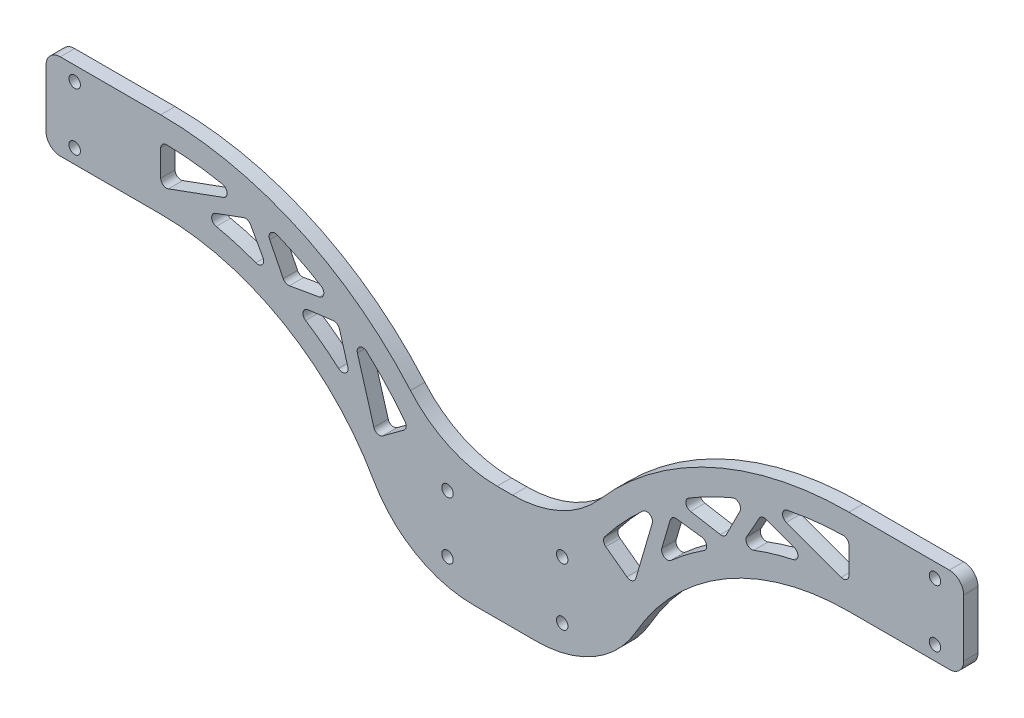
from build123d import *

# Parameters (mm, degrees)
ESQUISSE1_R        = 2
BOSS_EXTRU_1_DEPTH = 5
CONG_1_R           = 5
CONG_2_R           = 40
CONG_3_R           = 2


with BuildPart() as part:
    # Esquisse1 → Boss.-Extru.1 (new body)
    with BuildSketch(Plane.XY):
        with BuildLine():
            Line((-37.5, 0), (37.5, 0))
            ThreePointArc((37.5, 0), (67.945941561, 45.786768838), (120, 63.5))
            Line((120, 63.5), (160, 63.5))
            Line((160, 63.5), (160, 93.5))
            Line((160, 93.5), (120, 93.5))
            ThreePointArc((120, 93.5), (64.453511348, 79.243999919), (22.637791694, 40))
            Line((22.637791694, 40), (-22.637791694, 40))
            ThreePointArc((-22.637791694, 40), (-64.453511348, 79.243999919), (-120, 93.5))
            Line((-120, 93.5), (-160, 93.5))
            Line((-160, 93.5), (-160, 63.5))
            Line((-160, 63.5), (-120, 63.5))
            ThreePointArc((-120, 63.5), (-67.945941561, 45.786768838), (-37.5, 0))
        make_face()
        with Locations((20, 30)):
            Circle(ESQUISSE1_R, mode=Mode.SUBTRACT)
        with Locations((-20, 30)):
            Circle(ESQUISSE1_R, mode=Mode.SUBTRACT)
        with Locations((-20, 10)):
            Circle(ESQUISSE1_R, mode=Mode.SUBTRACT)
        with Locations((20, 10)):
            Circle(ESQUISSE1_R, mode=Mode.SUBTRACT)
        with Locations((150, 88.5)):
            Circle(ESQUISSE1_R, mode=Mode.SUBTRACT)
        with Locations((150, 68.5)):
            Circle(ESQUISSE1_R, mode=Mode.SUBTRACT)
        with Locations((-150, 88.5)):
            Circle(ESQUISSE1_R, mode=Mode.SUBTRACT)
        with Locations((-150, 68.5)):
            Circle(ESQUISSE1_R, mode=Mode.SUBTRACT)
        with BuildLine():
            Line((120, 85.5), (120, 71.5))
            Line((120, 71.5), (91.912412909, 81.760105686))
            ThreePointArc((91.912412909, 81.760105686), (105.832260607, 84.560918666), (120, 85.5))
        make_face(mode=Mode.SUBTRACT)
        with BuildLine():
            Line((44.869226881, 33.548751393), (33.600720018, 41.856624351))
            ThreePointArc((33.600720018, 41.856624351), (42.763993121, 52.702874362), (53.278657874, 62.244810141))
            Line((53.278657874, 62.244810141), (44.869226881, 33.548751393))
        make_face(mode=Mode.SUBTRACT)
        with BuildLine():
            Line((52.630031511, 42.764858585), (58.158997811, 61.631716745))
            Line((58.158997811, 61.631716745), (74.382302486, 59.593661799))
            ThreePointArc((74.382302486, 59.593661799), (62.882968201, 51.984783256), (52.630031511, 42.764858585))
        make_face(mode=Mode.SUBTRACT)
        with BuildLine():
            Line((59.726445752, 66.980423245), (76.611394643, 64.052400369))
            Line((76.611394643, 64.052400369), (84.274506387, 79.380529263))
            ThreePointArc((84.274506387, 79.380529263), (71.601705042, 73.969909454), (59.726445752, 66.980423245))
        make_face(mode=Mode.SUBTRACT)
        with BuildLine():
            Line((81.522990402, 63.200679417), (89.509798834, 77.468130963))
            Line((89.509798834, 77.468130963), (107.976603852, 70.722397677))
            ThreePointArc((107.976603852, 70.722397677), (94.471255289, 67.941160205), (81.522990402, 63.200679417))
        make_face(mode=Mode.SUBTRACT)
        with BuildLine():
            Line((-120, 85.5), (-120, 71.5))
            Line((-120, 71.5), (-91.912412909, 81.760105686))
            ThreePointArc((-91.912412909, 81.760105686), (-105.832260607, 84.560918666), (-120, 85.5))
        make_face(mode=Mode.SUBTRACT)
        with BuildLine():
            Line((-89.509798834, 77.468130963), (-107.976603852, 70.722397677))
            ThreePointArc((-107.976603852, 70.722397677), (-94.471255289, 67.941160205), (-81.522990402, 63.200679417))
            Line((-81.522990402, 63.200679417), (-89.509798834, 77.468130963))
        make_face(mode=Mode.SUBTRACT)
        with BuildLine():
            Line((-76.611394643, 64.052400369), (-84.274506387, 79.380529263))
            ThreePointArc((-84.274506387, 79.380529263), (-71.601705042, 73.969909454), (-59.726445752, 66.980423245))
            Line((-59.726445752, 66.980423245), (-76.611394643, 64.052400369))
        make_face(mode=Mode.SUBTRACT)
        with BuildLine():
            Line((-58.158997811, 61.631716745), (-74.382302486, 59.593661799))
            ThreePointArc((-74.382302486, 59.593661799), (-62.882968201, 51.984783256), (-52.630031511, 42.764858585))
            Line((-52.630031511, 42.764858585), (-58.158997811, 61.631716745))
        make_face(mode=Mode.SUBTRACT)
        with BuildLine():
            Line((-44.869226881, 33.548751393), (-33.600720018, 41.856624351))
            ThreePointArc((-33.600720018, 41.856624351), (-42.763993121, 52.702874362), (-53.278657874, 62.244810141))
            Line((-53.278657874, 62.244810141), (-44.869226881, 33.548751393))
        make_face(mode=Mode.SUBTRACT)
    extrude(amount=BOSS_EXTRU_1_DEPTH)

    # Congé1
    cong_1_edges = [part.edges().sort_by_distance(p)[0] for p in [
        (160, 93.5, 2.5),
        (160, 63.5, 2.5),
        (-160, 63.5, 2.5),
        (-160, 93.5, 2.5),
    ]]
    fillet(cong_1_edges, radius=CONG_1_R)

    # Congé2
    cong_2_edges = [part.edges().sort_by_distance(p)[0] for p in [
        (-22.637791694, 40, 2.5),
        (22.637791694, 40, 2.5),
        (37.5, 0, 2.5),
        (-37.5, 0, 2.5),
    ]]
    fillet(cong_2_edges, radius=CONG_2_R)

    # Congé3
    cong_3_edges = [part.edges().sort_by_distance(p)[0] for p in [
        (-58.158997811, 61.631716745, 2.5),
        (-74.382302486, 59.593661799, 2.5),
        (-52.630031511, 42.764858585, 2.5),
        (-76.611394643, 64.052400369, 2.5),
        (-59.726445752, 66.980423245, 2.5),
        (-84.274506387, 79.380529263, 2.5),
        (-120, 71.5, 2.5),
        (-91.912412909, 81.760105686, 2.5),
        (-120, 85.5, 2.5),
        (89.509798834, 77.468130963, 2.5),
        (81.522990402, 63.200679417, 2.5),
        (107.976603852, 70.722397677, 2.5),
        (44.869226881, 33.548751393, 2.5),
        (53.278657874, 62.244810141, 2.5),
        (33.600720018, 41.856624351, 2.5),
        (59.726445752, 66.980423245, 2.5),
        (76.611394643, 64.052400369, 2.5),
        (84.274506387, 79.380529263, 2.5),
        (91.912412909, 81.760105686, 2.5),
        (120, 71.5, 2.5),
        (120, 85.5, 2.5),
        (74.382302486, 59.593661799, 2.5),
        (58.158997811, 61.631716745, 2.5),
        (52.630031511, 42.764858585, 2.5),
        (-81.522990402, 63.200679417, 2.5),
        (-89.509798834, 77.468130963, 2.5),
        (-107.976603852, 70.722397677, 2.5),
        (-53.278657874, 62.244810141, 2.5),
        (-44.869226881, 33.548751393, 2.5),
        (-33.600720018, 41.856624351, 2.5),
    ]]
    fillet(cong_3_edges, radius=CONG_3_R)


solid = part.part
